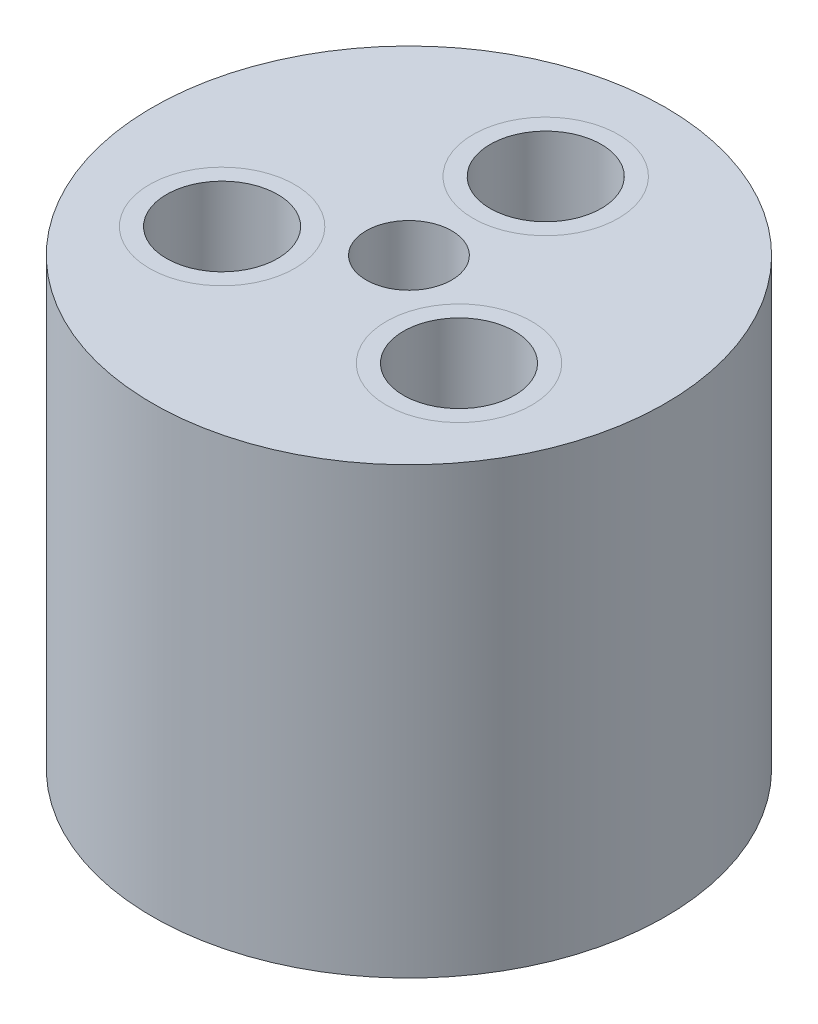
from build123d import *

# Parameters (mm, degrees)
IZIM1_R                       = 15
IZIM1_R_2                     = 2.5
Y_KSEKLIK_EKSTR_ZYON1_DEPTH   = 26
IZIM2_R                       = 4.25
KES_EKSTR_ZYON2_DEPTH         = 34.555923471
IZIM5_R                       = 4.25
IZIM5_R_2                     = 3.25
Y_KSEKLIK_EKSTR_ZYON4_DEPTH   = 26
Y_KSEKLIK_EKSTR_ZYON4_2_DEPTH = 26
Y_KSEKLIK_EKSTR_ZYON4_3_DEPTH = 26


with BuildPart() as part:
    # Çizim1 → Yükseklik-Ekstrüzyon1 (new body)
    with BuildSketch(Plane(origin=(0, 0, 0), x_dir=(1, 0, 0), z_dir=(0, 1, 0))):
        with Locations(Location((0, 0, 0), (0, 0, 90))):
            Circle(IZIM1_R)
        with Locations(Location((0, 0, 0), (0, 0, 90))):
            Circle(IZIM1_R_2, mode=Mode.SUBTRACT)
    extrude(amount=Y_KSEKLIK_EKSTR_ZYON1_DEPTH)

    # Çizim2 → Kes-Ekstrüzyon2 (cut, through all)
    with BuildSketch(Plane(origin=(0, 26, 0), x_dir=(1, 0, 0), z_dir=(0, 1, 0))):
        with Locations(Location((0, 8, 0), (0, 0, 270))):
            Circle(IZIM2_R)
        with Locations(Location((6.92820323, -4, 0), (0, 0, 270))):
            Circle(IZIM2_R)
        with Locations(Location((-6.92820323, -4, 0), (0, 0, 270))):
            Circle(IZIM2_R)
    extrude(amount=-KES_EKSTR_ZYON2_DEPTH, mode=Mode.SUBTRACT)


with BuildPart() as body_2:
    # Çizim5 → Yükseklik-Ekstrüzyon4 (new, through all)
    with BuildSketch(Plane(origin=(0, 26, 0), x_dir=(1, 0, 0), z_dir=(0, 1, 0))):
        with Locations(Location((6.92820323, -4, 0), (0, 0, 270))):
            Circle(IZIM5_R)
        with Locations(Location((6.92820323, -4, 0), (0, 0, 270))):
            Circle(IZIM5_R_2, mode=Mode.SUBTRACT)
    extrude(amount=-Y_KSEKLIK_EKSTR_ZYON4_DEPTH)


with BuildPart() as body_3:
    # Çizim5 → Y_kseklik-Ekstr_zyon4 2 (new, through all)
    with BuildSketch(Plane(origin=(0, 26, 0), x_dir=(1, 0, 0), z_dir=(0, 1, 0))):
        with Locations(Location((-6.92820323, -4, 0), (0, 0, 270))):
            Circle(IZIM5_R)
        with Locations(Location((-6.92820323, -4, 0), (0, 0, 270))):
            Circle(IZIM5_R_2, mode=Mode.SUBTRACT)
    extrude(amount=-Y_KSEKLIK_EKSTR_ZYON4_2_DEPTH)


with BuildPart() as body_4:
    # Çizim5 → Y_kseklik-Ekstr_zyon4 3 (new, through all)
    with BuildSketch(Plane(origin=(0, 26, 0), x_dir=(1, 0, 0), z_dir=(0, 1, 0))):
        with Locations(Location((0, 8, 0), (0, 0, 270))):
            Circle(IZIM5_R)
        with Locations(Location((0, 8, 0), (0, 0, 270))):
            Circle(IZIM5_R_2, mode=Mode.SUBTRACT)
    extrude(amount=-Y_KSEKLIK_EKSTR_ZYON4_3_DEPTH)


solid = Compound([part.part, body_2.part, body_3.part, body_4.part])
